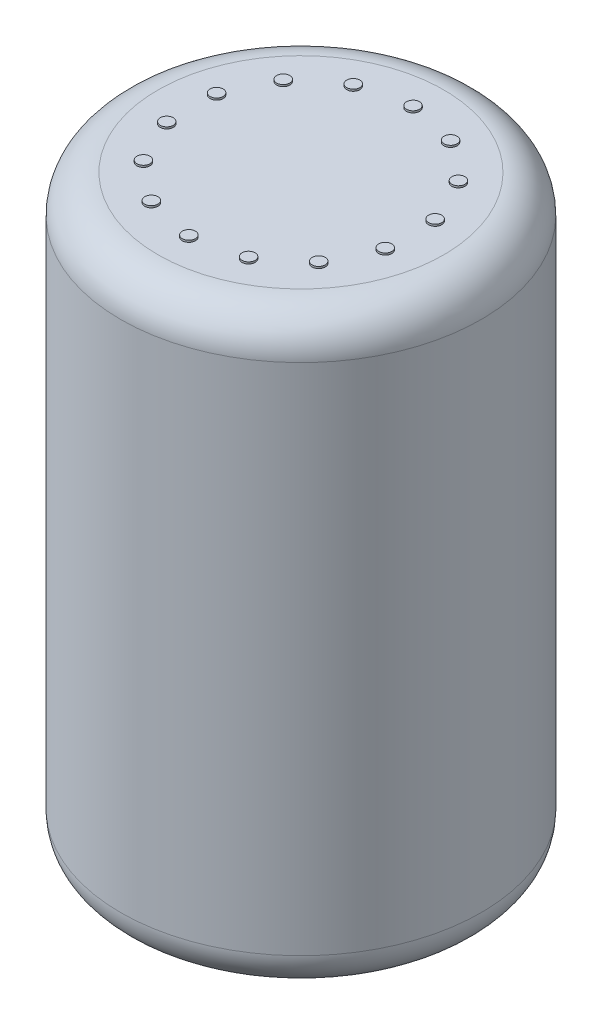
from build123d import *

# Parameters (mm, degrees)
SKETCH1_R           = 9.65
BOSS_EXTRUDE1_DEPTH = 31.5
FILLET4_R           = 2
SKETCH2_R           = 0.35
BOSS_EXTRUDE2_DEPTH = 0.1
CIRPATTERN1_COUNT   = 14


with BuildPart() as part:
    # Sketch1 → Boss-Extrude1 (new body)
    with BuildSketch(Plane(origin=(0, 0, 0), x_dir=(1, 0, 0), z_dir=(0, 1, 0))):
        with Locations(Location((0, 0, 0), (0, 0, 270))):
            Circle(SKETCH1_R)
    extrude(amount=BOSS_EXTRUDE1_DEPTH)

    # Fillet4
    fillet4_edges = [part.edges().sort_by_distance(p)[0] for p in [
        (0, 0, -9.65),
        (0, 31.5, -9.65),
    ]]
    fillet(fillet4_edges, radius=FILLET4_R)

    # Sketch2 → Boss-Extrude2 (add)
    with BuildSketch(Plane(origin=(0, 31.5, 0), x_dir=(1, 0, 0), z_dir=(0, 1, 0))):
        with Locations(Location((0, 6, 0), (0, 0, 270))):
            Circle(SKETCH2_R)
    boss_extrude2 = extrude(amount=BOSS_EXTRUDE2_DEPTH)

    # CirPattern1: Boss-Extrude2 ×14 about axis
    cirpattern1_axis = Axis((0, 0, 0), (0, 1, 0))
    for i in range(1, CIRPATTERN1_COUNT):
        add(boss_extrude2.rotate(cirpattern1_axis, i * 360 / CIRPATTERN1_COUNT))


solid = part.part
